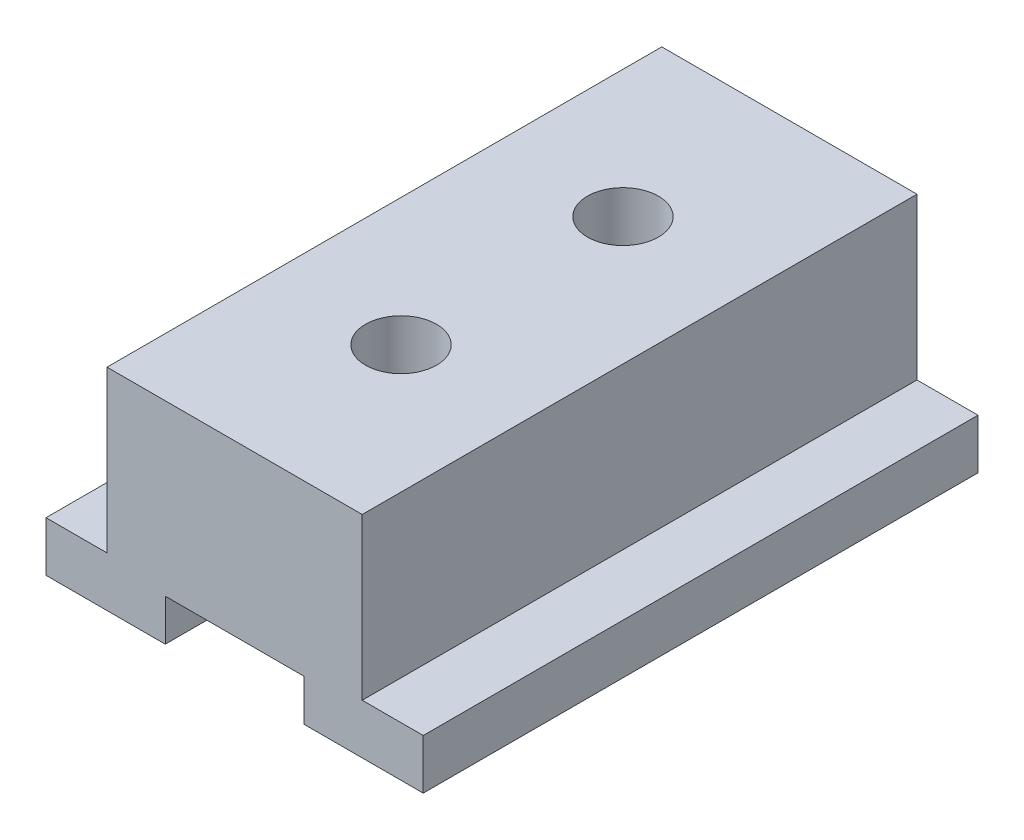
from build123d import *

# Parameters (mm, degrees)
BOSS_EXTRUDE1_DEPTH  = 50
M6_CLEARANCE_HOLE1_D = 6.4


with BuildPart() as part:
    # Sketch1 → Boss-Extrude1 (new body)
    with BuildSketch(Plane.XY):
        Polygon((0, 0), (0, 4.5), (5.5, 4.5), (5.5, 19), (28.5, 19), (28.5, 4.5), (34, 4.5), (34, 0), (23.25, 0), (23.25, 3.75), (10.75, 3.75), (10.75, 0), align=None)
    extrude(amount=BOSS_EXTRUDE1_DEPTH)

    # M6 Clearance Hole1 (through all)
    with Locations(Plane(origin=(17, 19, 15), x_dir=(0, 0, 1), z_dir=(0, 1, 0))):
        with Locations((0, 0), (20, 0)):
            Hole(M6_CLEARANCE_HOLE1_D / 2)


solid = part.part
